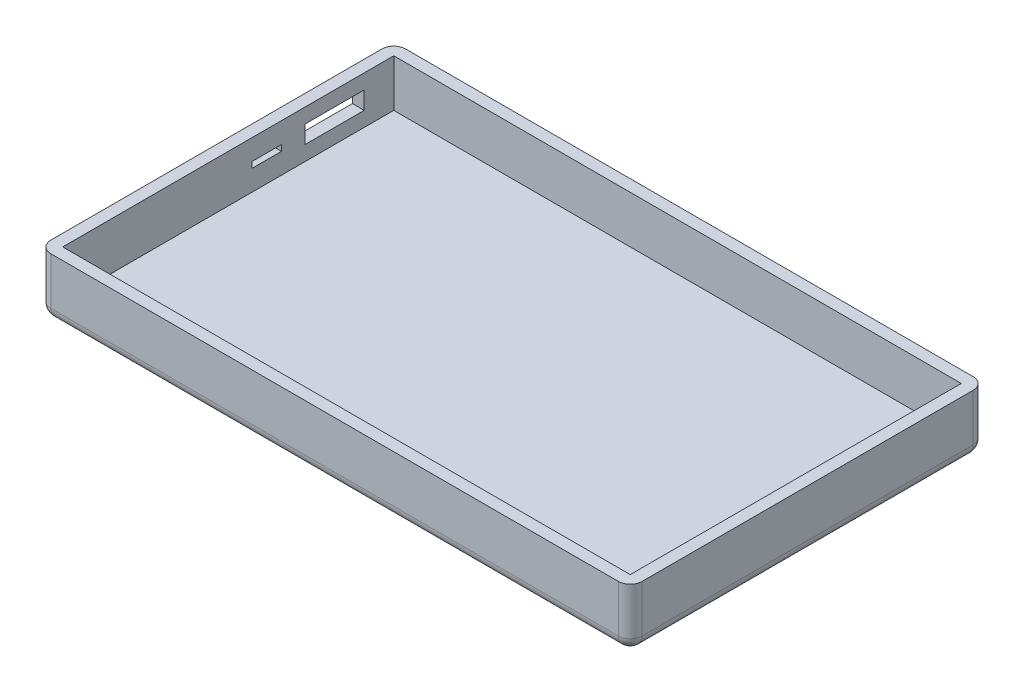
from build123d import *

# Parameters (mm, degrees)
SKETCH1_W           = 100
SKETCH1_H           = 60
BOSS_EXTRUDE1_DEPTH = 10
SHELL1_T            = -2
FILLET1_R           = 2
SKETCH2_W           = 5
SKETCH2_H           = 1
SKETCH2_W_2         = 10
SKETCH2_H_2         = 3
CUT_EXTRUDE1_DEPTH  = 2


with BuildPart() as part:
    # Sketch1 → Boss-Extrude1 (new body)
    with BuildSketch(Plane(origin=(0, 0, 0), x_dir=(1, 0, 0), z_dir=(0, 1, 0))):
        Rectangle(SKETCH1_W, SKETCH1_H)
    extrude(amount=BOSS_EXTRUDE1_DEPTH)

    # Shell1
    shell1_openings = [part.faces().sort_by_distance(p)[0] for p in [
        (0, 10, 0),
    ]]
    offset(amount=SHELL1_T, openings=shell1_openings, kind=Kind.INTERSECTION)

    # Fillet1
    fillet1_edges = [part.edges().sort_by_distance(p)[0] for p in [
        (0, 0, -30),
        (50, 0, 0),
        (0, 0, 30),
        (-50, 0, 0),
        (-50, 5, -30),
        (50, 5, -30),
        (50, 5, 30),
        (-50, 5, 30),
    ]]
    fillet(fillet1_edges, radius=FILLET1_R)

    # Sketch2 → Cut-Extrude1 (cut)
    with BuildSketch(Plane.ZY.offset(50)):
        with Locations((-6.5, 6)):
            Rectangle(SKETCH2_W, SKETCH2_H)
        with Locations((-18, 6)):
            Rectangle(SKETCH2_W_2, SKETCH2_H_2)
    extrude(amount=-CUT_EXTRUDE1_DEPTH, mode=Mode.SUBTRACT)


solid = part.part
